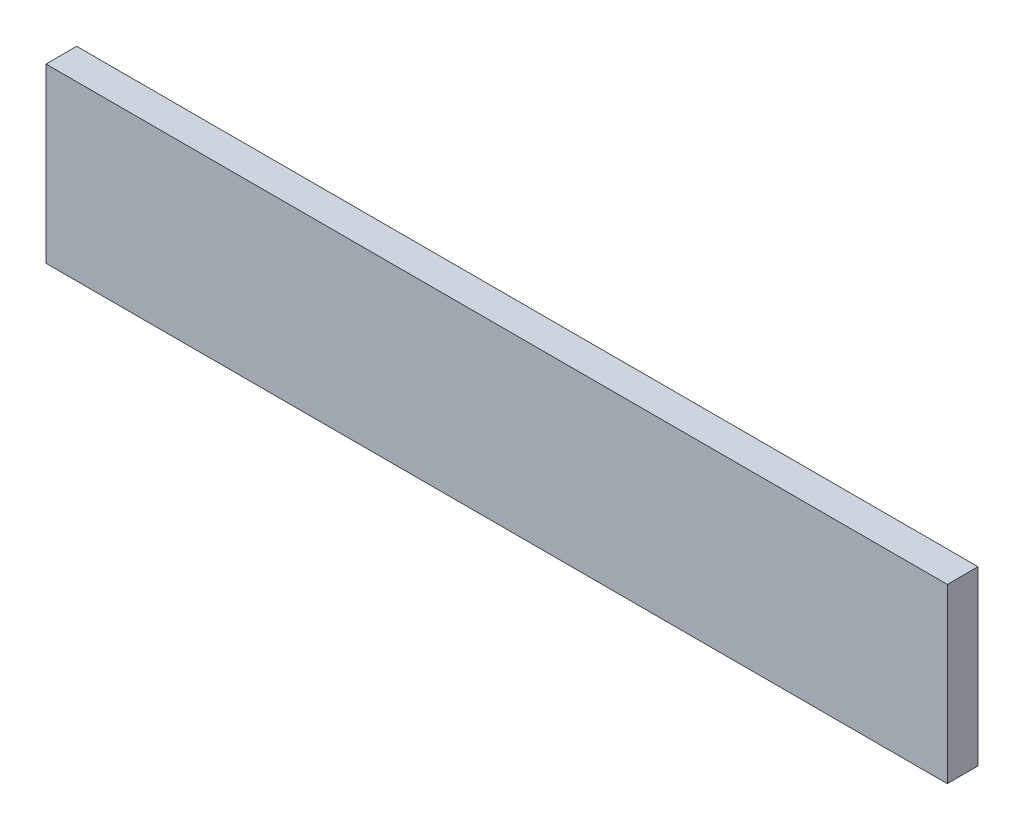
from build123d import *

# Parameters (mm, degrees)
SKETCH_1_W      = 235
SKETCH_1_H      = 45
EXTRUDE_1_DEPTH = 8


with BuildPart() as part:
    # 草图1 → 凸台-拉伸1 (new body)
    with BuildSketch(Plane.XY):
        with Locations((2.357859532, 18.789547428)):
            Rectangle(SKETCH_1_W, SKETCH_1_H)
    extrude(amount=EXTRUDE_1_DEPTH)


solid = part.part
